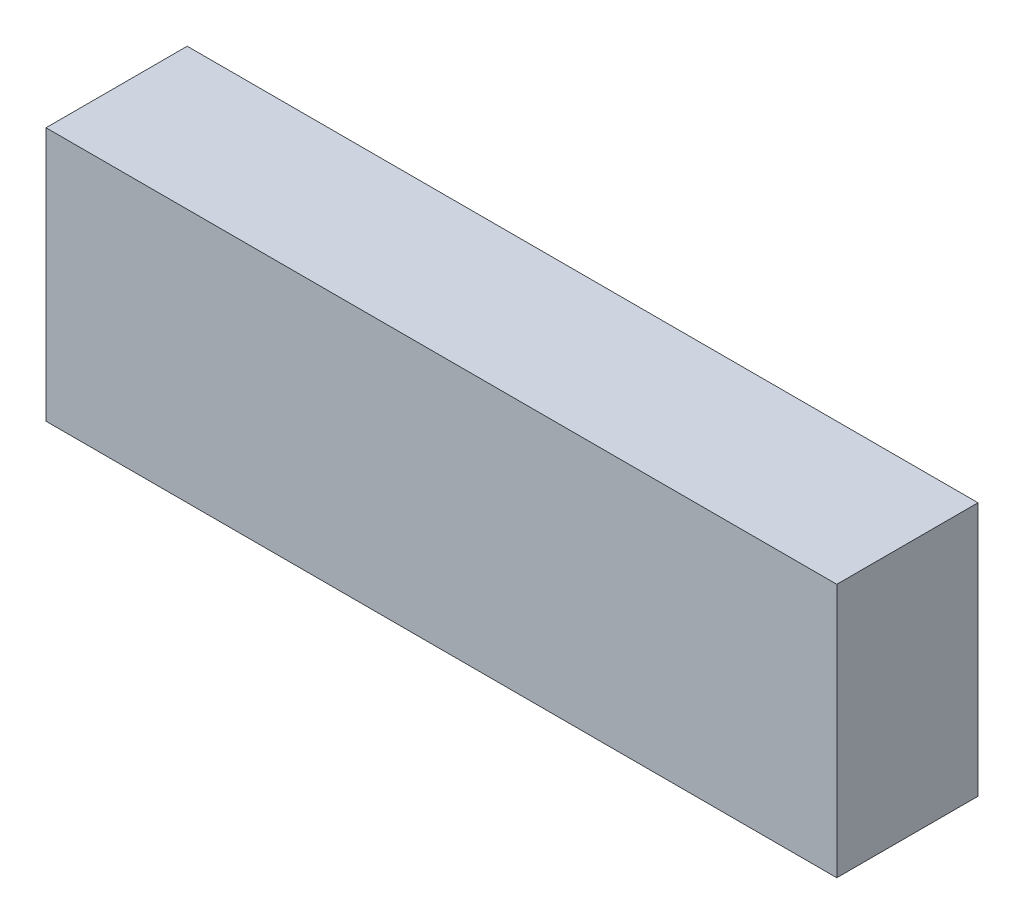
from build123d import *

# Parameters (mm, degrees)
SKETCH1_W           = 140
SKETCH1_H           = 45
BOSS_EXTRUDE1_DEPTH = 25
SKETCH1_3_W         = 140
SKETCH1_3_H         = 45
BOSS_EXTRUDE2_DEPTH = 12.5


with BuildPart() as part:
    # Sketch1 → Boss-Extrude1 (new body)
    with BuildSketch(Plane.XY):
        with Locations((70, 22.5)):
            Rectangle(SKETCH1_W, SKETCH1_H)
    extrude(amount=BOSS_EXTRUDE1_DEPTH)

    # Sketch1<3> → Boss-Extrude2 (add)
    with BuildSketch(Plane.XY):
        with Locations((70, 22.5)):
            Rectangle(SKETCH1_3_W, SKETCH1_3_H)
    extrude(amount=BOSS_EXTRUDE2_DEPTH)


solid = part.part
